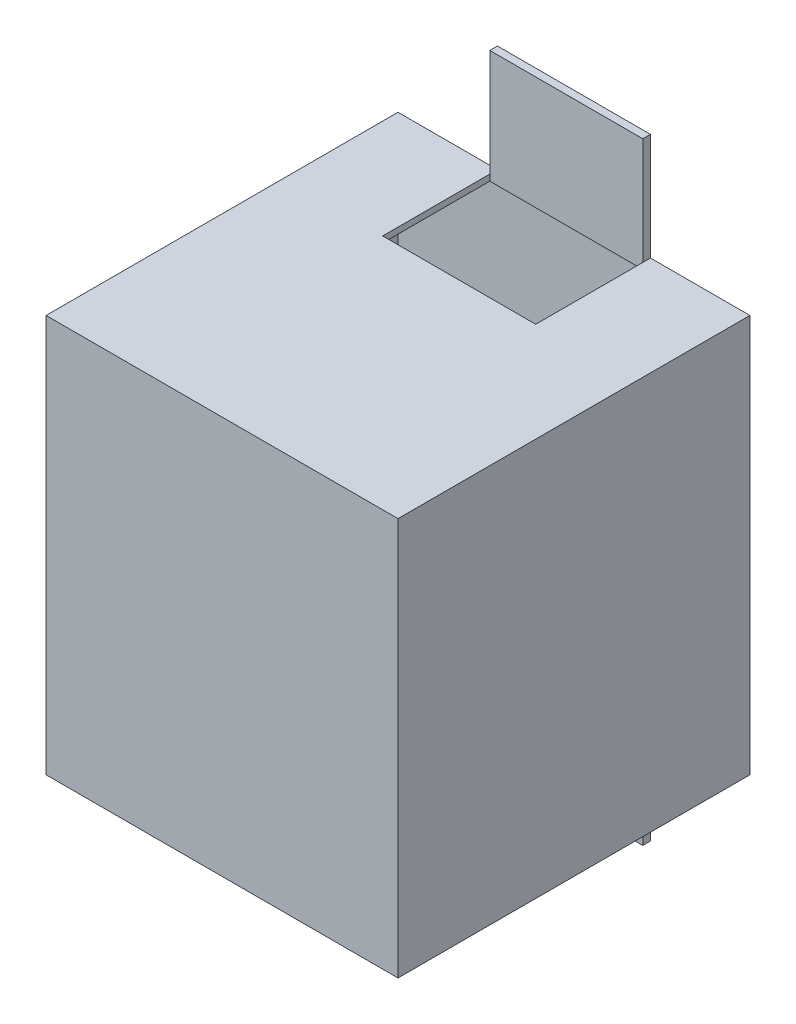
from build123d import *

# Parameters (mm, degrees)
ESQUISSE1_W             = 230
ESQUISSE1_H             = 260
BOSS_EXTRU_1_DEPTH      = 230
ESQUISSE2_W             = 222
ESQUISSE2_H             = 222
ENL_V_MAT_EXTRU_1_DEPTH = 256
ESQUISSE3_W             = 230
ESQUISSE3_H             = 230
BOSS_EXTRU_2_DEPTH      = 4
ESQUISSE4_W             = 100
ESQUISSE4_H             = 70
ENL_V_MAT_EXTRU_2_DEPTH = 456
ESQUISSE5_W             = 100
ESQUISSE5_H             = 5
BOSS_EXTRU_3_DEPTH      = 70
ESQUISSE6_W             = 100
ESQUISSE6_H             = 5
BOSS_EXTRU_4_DEPTH      = 70


with BuildPart() as part:
    # Esquisse1 → Boss.-Extru.1 (new body)
    with BuildSketch(Plane.XY):
        with Locations((115, -130)):
            Rectangle(ESQUISSE1_W, ESQUISSE1_H)
    extrude(amount=BOSS_EXTRU_1_DEPTH)

    # Esquisse2 → Enlèv. mat.-Extru.1 (cut)
    with BuildSketch(Plane.XZ.offset(260)):
        with Locations((115, 115)):
            Rectangle(ESQUISSE2_W, ESQUISSE2_H)
    extrude(amount=-ENL_V_MAT_EXTRU_1_DEPTH, mode=Mode.SUBTRACT)

    # Esquisse3 → Boss.-Extru.2 (add)
    with BuildSketch(Plane.XZ.offset(260)):
        with Locations((115, 115)):
            Rectangle(ESQUISSE3_W, ESQUISSE3_H)
    extrude(amount=-BOSS_EXTRU_2_DEPTH)

    # Esquisse4 → Enlèv. mat.-Extru.2 (cut)
    with BuildSketch(Plane.XZ.offset(260)):
        with Locations((115, 40)):
            Rectangle(ESQUISSE4_W, ESQUISSE4_H)
    extrude(amount=-ENL_V_MAT_EXTRU_2_DEPTH, mode=Mode.SUBTRACT)

    # Esquisse5 → Boss.-Extru.3 (add)
    with BuildSketch(Plane.XZ.offset(260)):
        with Locations((115, 2.5)):
            Rectangle(ESQUISSE5_W, ESQUISSE5_H)
    extrude(amount=BOSS_EXTRU_3_DEPTH)

    # Esquisse6 → Boss.-Extru.4 (add)
    with BuildSketch(Plane(origin=(0, 0, 0), x_dir=(1, 0, 0), z_dir=(0, 1, 0))):
        with Locations((115, -2.5)):
            Rectangle(ESQUISSE6_W, ESQUISSE6_H)
    extrude(amount=BOSS_EXTRU_4_DEPTH)


solid = part.part
